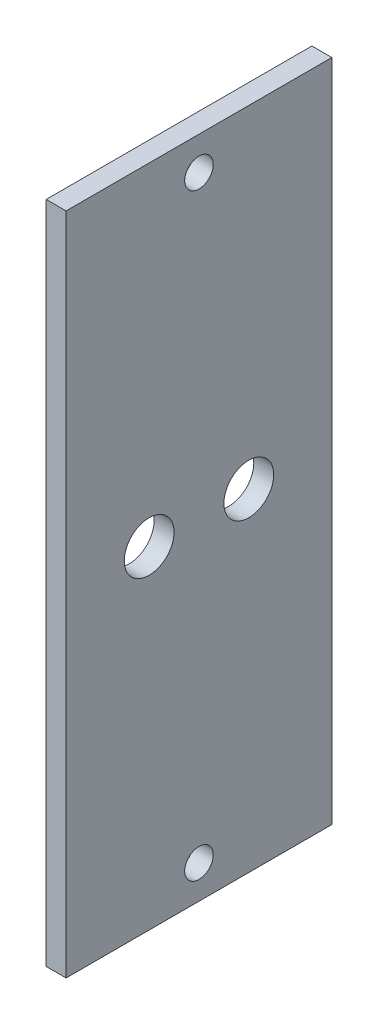
from build123d import *

# Parameters (mm, degrees)
SKETCH1_W           = 40
SKETCH1_H           = 100
SKETCH1_R           = 2.15
SKETCH1_R_2         = 3.75
BOSS_EXTRUDE2_DEPTH = 3


with BuildPart() as part:
    # Sketch1 → Boss-Extrude2 (new body)
    with BuildSketch(Plane(origin=(0, 0, 0), x_dir=(0, 0, -1), z_dir=(1, 0, 0))):
        with Locations((20, 50)):
            Rectangle(SKETCH1_W, SKETCH1_H)
        with Locations((20, 95)):
            Circle(SKETCH1_R, mode=Mode.SUBTRACT)
        with Locations((20, 5)):
            Circle(SKETCH1_R, mode=Mode.SUBTRACT)
        with Locations((12.5, 50)):
            Circle(SKETCH1_R_2, mode=Mode.SUBTRACT)
        with Locations((27.5, 50)):
            Circle(SKETCH1_R_2, mode=Mode.SUBTRACT)
    extrude(amount=BOSS_EXTRUDE2_DEPTH)


solid = part.part
